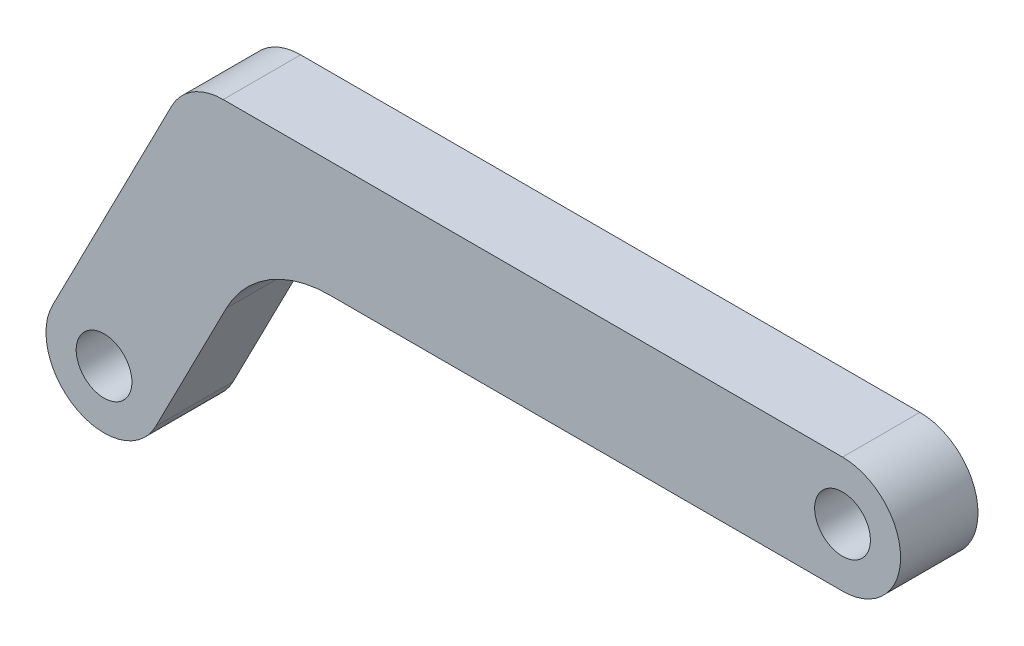
from build123d import *

# Parameters (mm, degrees)
SKETCH1_R           = 2.286
BOSS_EXTRUDE1_DEPTH = 6.35


with BuildPart() as part:
    # Sketch1 → Boss-Extrude1 (new body)
    with BuildSketch(Plane.XY):
        with BuildLine():
            Line((-64.812361209, -16.875751472), (-55.037221919, 2.174248528))
            ThreePointArc((-55.037221919, 2.174248528), (-53.282594171, 4.064250538), (-50.8, 4.7625))
            Line((-50.8, 4.7625), (0, 4.7625))
            ThreePointArc((0, 4.7625), (4.7625, 0), (0, -4.7625))
            Line((0, -4.7625), (-42.07266789, -4.7625))
            ThreePointArc((-42.07266789, -4.7625), (-47.037856232, -6.158998925), (-50.547111728, -9.939002944))
            Line((-50.547111728, -9.939002944), (-56.337917371, -21.224248528))
            ThreePointArc((-56.337917371, -21.224248528), (-62.749387818, -23.287221919), (-64.812361209, -16.875751472))
        make_face()
        Circle(SKETCH1_R, mode=Mode.SUBTRACT)
        with Locations((-60.57513929, -19.05)):
            Circle(SKETCH1_R, mode=Mode.SUBTRACT)
    extrude(amount=BOSS_EXTRUDE1_DEPTH)


solid = part.part
